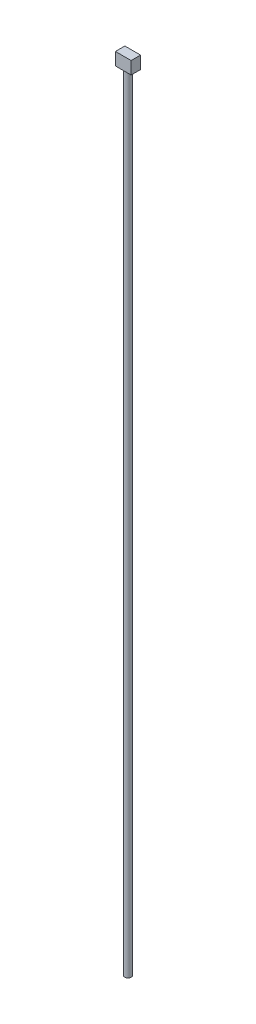
from build123d import *

# Parameters (mm, degrees)
SKETCH_1_R      = 0.525
EXTRUDE_1_DEPTH = 125
SKETCH_2_W      = 2.5
SKETCH_2_H      = 1.5
EXTRUDE_6_DEPTH = 2


with BuildPart() as part:
    # 草图1 → 凸台-拉伸1 (new body)
    with BuildSketch(Plane(origin=(0, 0, 0), x_dir=(1, 0, 0), z_dir=(0, 1, 0))):
        with Locations(Location((0, 0, 0), (0, 0, 270))):
            Circle(SKETCH_1_R)
    extrude(amount=EXTRUDE_1_DEPTH)

    # 草图2 → 凸台-拉伸6 (add)
    with BuildSketch(Plane(origin=(0, 125, 0), x_dir=(1, 0, 0), z_dir=(0, 1, 0))):
        Rectangle(SKETCH_2_W, SKETCH_2_H)
    extrude(amount=EXTRUDE_6_DEPTH)


solid = part.part
